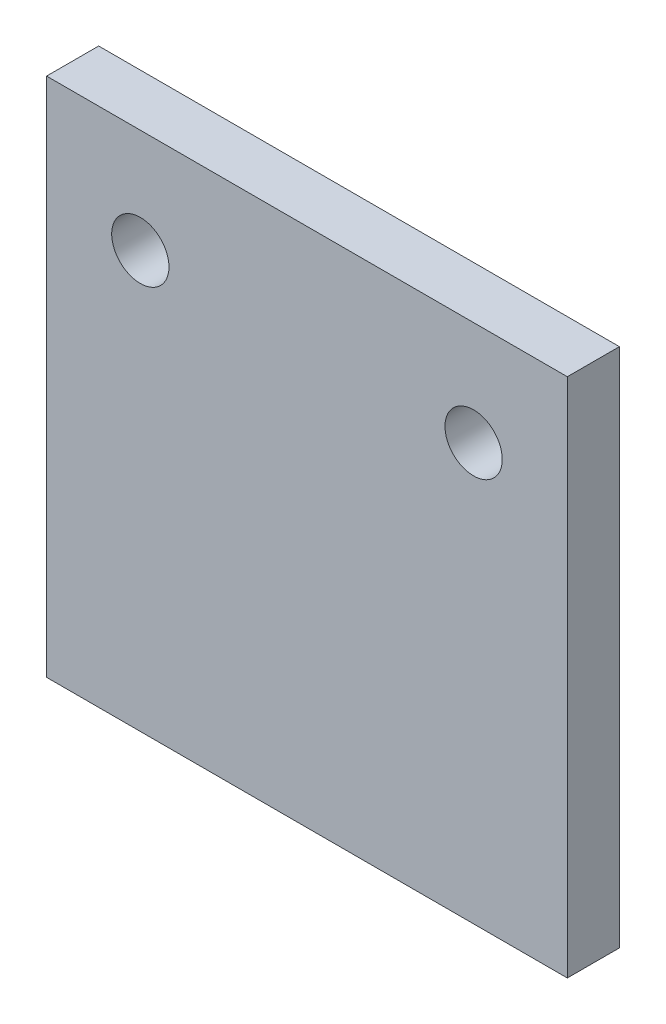
from build123d import *

# Parameters (mm, degrees)
SKETCH_2_W          = 50
SKETCH_2_H          = 50
EXTRUDE_1_DEPTH     = 5
SKETCH_3_R          = 2.75
CUT_EXTRUDE_1_DEPTH = 10


with BuildPart() as part:
    # 스케치2 → 보스-돌출1 (new body)
    with BuildSketch(Plane.XY):
        Rectangle(SKETCH_2_W, SKETCH_2_H)
    extrude(amount=EXTRUDE_1_DEPTH)

    # 스케치3 → 컷-돌출1 (cut)
    with BuildSketch(Plane.XY.offset(5)):
        with Locations((-16, 15)):
            Circle(SKETCH_3_R)
        with Locations((16, 15)):
            Circle(SKETCH_3_R)
    extrude(amount=-CUT_EXTRUDE_1_DEPTH, mode=Mode.SUBTRACT)


solid = part.part
